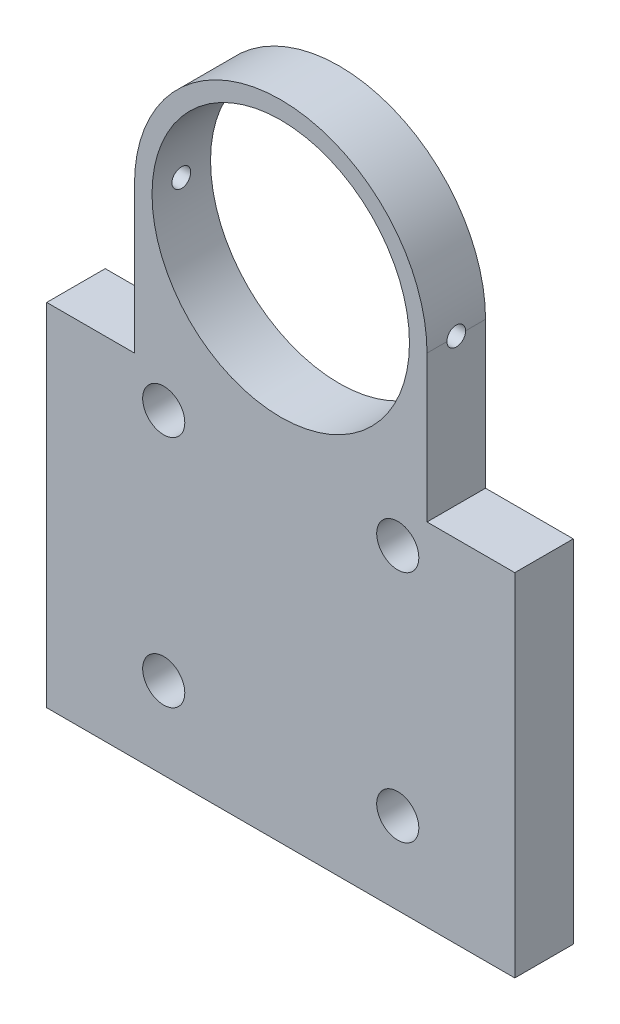
from build123d import *

# Parameters (mm, degrees)
ESQUISSE1_W                               = 40
ESQUISSE1_H                               = 30
BOSS_EXTRU_1_DEPTH                        = 5
BOSS_EXTRU_2_DEPTH                        = 5
TROUS_DE_CENTRAGE_1_0MM1_D                = 22
D_GAGEMENT_M34_D                          = 3.6
TROU_POUR_TARAUDAGE_POUR_TROU_TARAUD_M2_D = 1.6


with BuildPart() as part:
    # Esquisse1 → Boss.-Extru.1 (new body)
    with BuildSketch(Plane.XY):
        with Locations((-1, -4.421052632)):
            Rectangle(ESQUISSE1_W, ESQUISSE1_H)
    extrude(amount=BOSS_EXTRU_1_DEPTH)

    # Esquisse2 → Boss.-Extru.2 (add)
    with BuildSketch(Plane.XY.offset(5)):
        with BuildLine():
            Line((-13.5, 10.578947368), (11.5, 10.578947368))
            Line((11.5, 10.578947368), (11.5, 23.078947368))
            ThreePointArc((11.5, 23.078947368), (-1, 35.578947368), (-13.5, 23.078947368))
            Line((-13.5, 23.078947368), (-13.5, 10.578947368))
        make_face()
    extrude(amount=-BOSS_EXTRU_2_DEPTH)

    # Trous de centrage Ø1.0mm1 (through all)
    with Locations(Plane.XY.offset(5)):
        with Locations((-1, 23.078947368)):
            Hole(TROUS_DE_CENTRAGE_1_0MM1_D / 2)

    # Dégagement M34 (through all)
    with Locations(Plane.XY.offset(5)):
        with Locations((9, 7.578947368), (-11, 7.578947368), (-11, -12.421052632), (9, -12.421052632)):
            Hole(D_GAGEMENT_M34_D / 2)

    # Trou pour taraudage pour trou taraudé M23 (through all)
    with Locations(Plane(origin=(11.5, 0, 0), x_dir=(0, 0, -1), z_dir=(1, 0, 0))):
        with Locations((-2.5, 23.078947368)):
            Hole(TROU_POUR_TARAUDAGE_POUR_TROU_TARAUD_M2_D / 2)


solid = part.part
